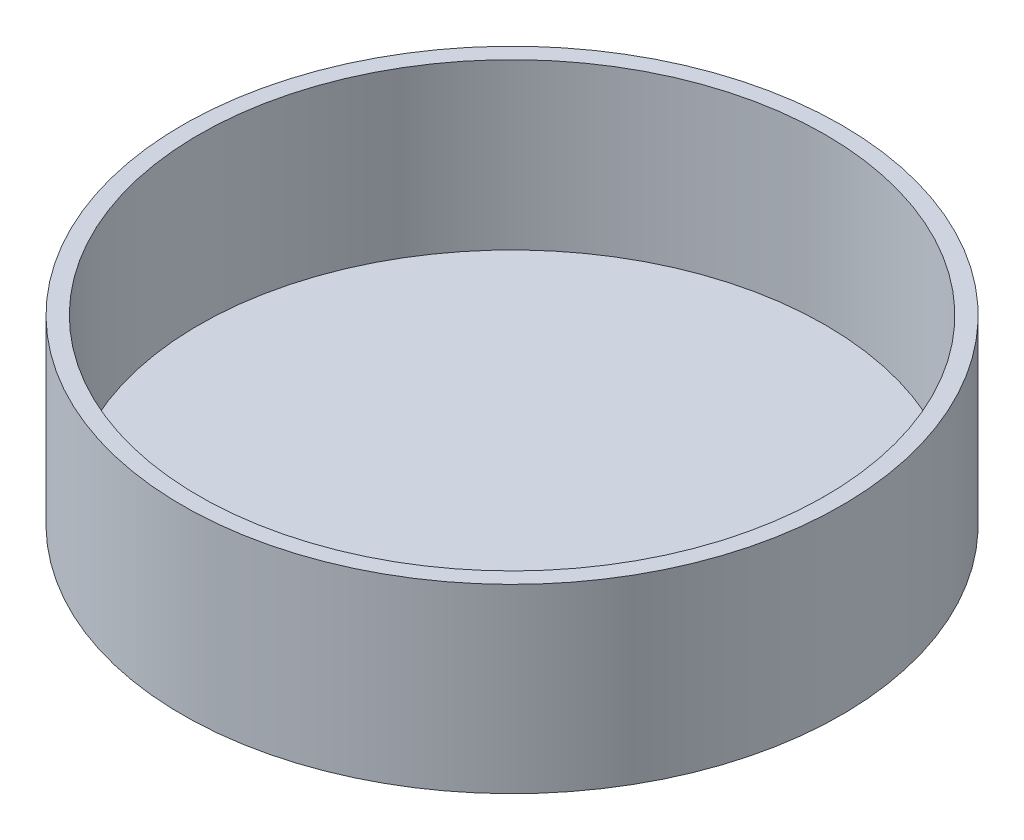
from build123d import *


with BuildPart() as part:
    # Sketch1 → Revolve-Thin1 (revolve)
    with BuildSketch(Plane.XY, mode=Mode.PRIVATE) as revolve_thin1_sk:
        Polygon((0, 0), (95, 0), (95, 50), (100, 50), (100, -5), (0, -5), align=None)
    revolve(revolve_thin1_sk.sketch.rotate(Axis((0, 0, 0), (0, 1, 0)), 90), axis=Axis((0, 0, 0), (0, 1, 0)))


solid = part.part
